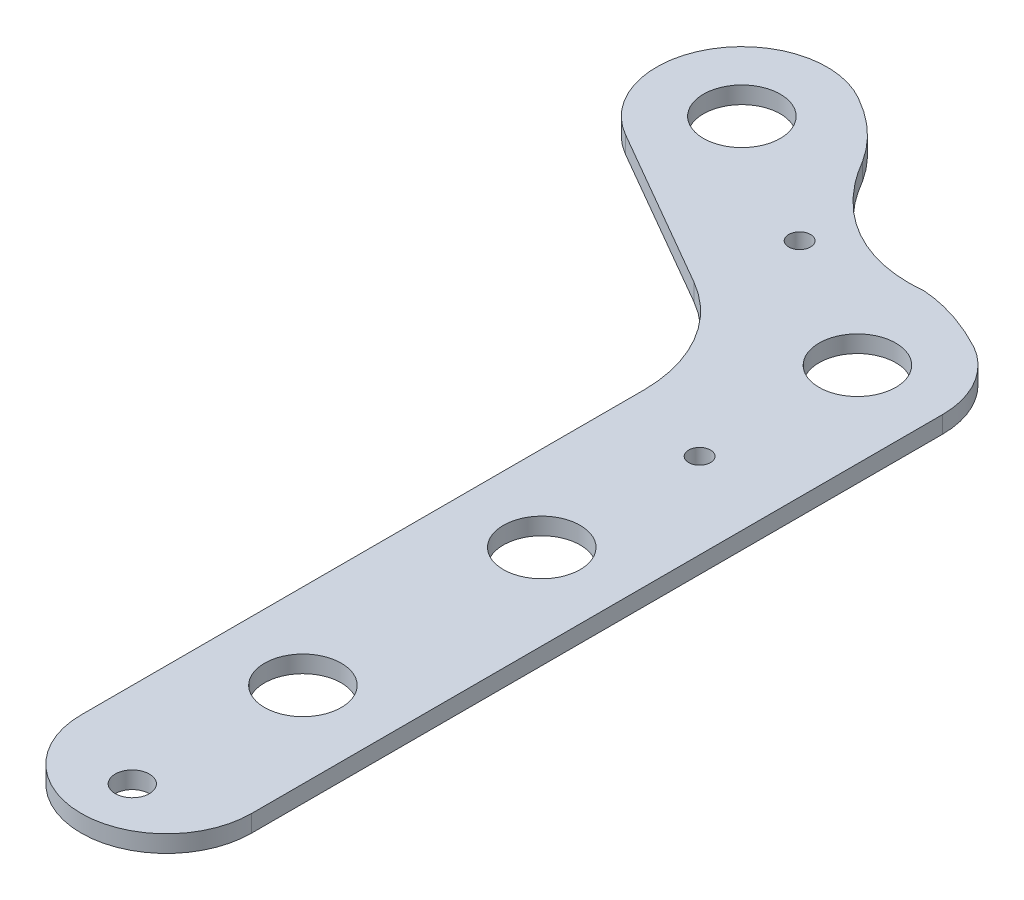
from build123d import *

# Parameters (mm, degrees)
SKETCH2_R           = 14.2875
SKETCH2_R_2         = 4.064
SKETCH2_R_3         = 6.35
BOSS_EXTRUDE1_DEPTH = 6.35


with BuildPart() as part:
    # Sketch2 → Boss-Extrude1 (new body)
    with BuildSketch(Plane(origin=(0, 0, 0), x_dir=(1, 0, 0), z_dir=(0, 1, 0))):
        with BuildLine():
            Line((31.75, -78.393028047), (31.75, 117.475))
            ThreePointArc((31.75, 117.475), (27.49630657, 133.35), (15.875, 144.97130657))
            add(Edge.make_bspline(
                [(-11.426385325, 153.835795689), (1.224450482, 152.855976047), (15.875, 144.97130657)],
                knots=[0, 0, 0, 1, 1, 1], degree=2))
            add(Edge.make_bspline(
                [(-64.783506655, 184.207168681), (-52.423507121, 162.771572898), (-33.18367174, 151.627706727), (-11.426385325, 153.835795689)],
                knots=[0, 0, 0, 0, 1, 1, 1, 1], degree=3))
            add(Edge.make_bspline(
                [(-85.86133431, 203.70880657), (-72.386286962, 196.104383794), (-64.783506655, 184.207168681)],
                knots=[0, 0, 0, 1, 1, 1], degree=2))
            ThreePointArc((-85.86133431, 203.70880657), (-129.23264088, 192.0875), (-117.61133431, 148.71619343))
            Line((-117.61133431, 148.71619343), (-57.15, 113.808825791))
            ThreePointArc((-57.15, 113.808825791), (-38.555909488, 95.214735278), (-31.75, 69.814735278))
            Line((-31.75, 69.814735278), (-31.75, -18.272918452))
            Line((-31.75, -18.272918452), (-31.75, -139.7))
            ThreePointArc((-31.75, -139.7), (0, -171.45), (31.75, -139.7))
            Line((31.75, -139.7), (31.75, -78.393028047))
        make_face()
        with Locations(Location((0, 0, 0), (0, 0, 270))):
            Circle(SKETCH2_R, mode=Mode.SUBTRACT)
        with Locations(Location((0, -88.9, 0), (0, 0, 270))):
            Circle(SKETCH2_R, mode=Mode.SUBTRACT)
        with Locations(Location((0, 117.475, 0), (0, 0, 270))):
            Circle(SKETCH2_R, mode=Mode.SUBTRACT)
        with Locations(Location((-101.73633431, 176.2125, 0), (0, 0, 270))):
            Circle(SKETCH2_R, mode=Mode.SUBTRACT)
        with Locations(Location((-50.868167155, 146.84375, 0), (0, 0, 270))):
            Circle(SKETCH2_R_2, mode=Mode.SUBTRACT)
        with Locations(Location((0, 58.7375, 0), (0, 0, 270))):
            Circle(SKETCH2_R_2, mode=Mode.SUBTRACT)
        with Locations(Location((0, -152.4, 0), (0, 0, 270))):
            Circle(SKETCH2_R_3, mode=Mode.SUBTRACT)
    extrude(amount=BOSS_EXTRUDE1_DEPTH)


solid = part.part
